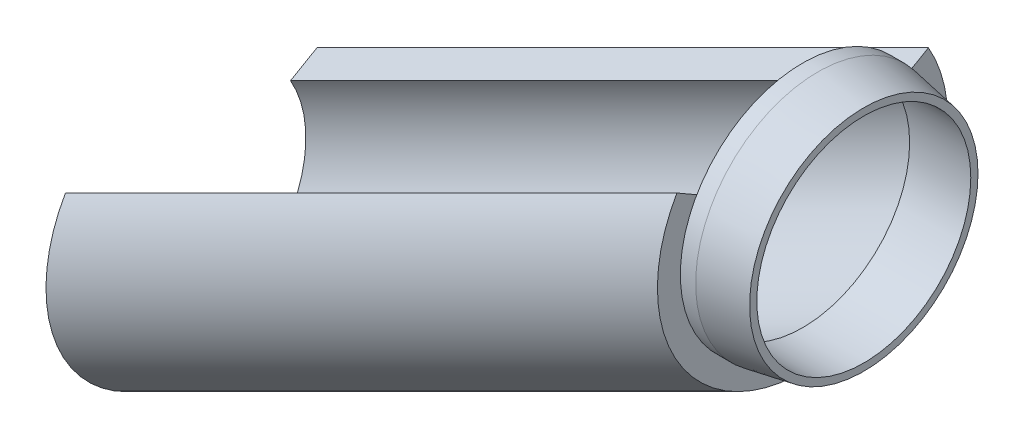
from build123d import *

# Parameters (mm, degrees)
SKETCH5_R           = 8
SKETCH5_R_2         = 7
BOSS_EXTRUDE1_DEPTH = 4
CHAMFER1_SIZE       = 3
CHAMFER1_SIZE2      = 0.528980942


with BuildPart() as part:
    # Sweep1: sweep along a path in Sketch4
    with BuildLine(Plane.XY) as sweep1_path:
        Line((0, 0), (-40, -20))
    # Sketch1 → Sweep1 (sweep)
    with BuildSketch(Plane(origin=(0, 0, 0), x_dir=(0, 0, -1), z_dir=(1, 0, 0))):
        with BuildLine():
            Line((6.495190528, 3.75), (8.227241336, 4.75))
            ThreePointArc((8.227241336, 4.75), (0, -9.5), (-8.227241336, 4.75))
            Line((-8.227241336, 4.75), (-6.495190528, 3.75))
            ThreePointArc((-6.495190528, 3.75), (0, -7.5), (6.495190528, 3.75))
        make_face()
    sweep(path=sweep1_path.line)


with BuildPart() as body_2:
    # Sketch5 → Boss-Extrude1 (new body)
    with BuildSketch(Plane(origin=(0, 0, 0), x_dir=(0, 0, -1), z_dir=(1, 0, 0))):
        Circle(SKETCH5_R)
        Circle(SKETCH5_R_2, mode=Mode.SUBTRACT)
    extrude(amount=BOSS_EXTRUDE1_DEPTH)

    # Chamfer1
    chamfer1_edges = [body_2.edges().sort_by_distance(p)[0] for p in [
        (4, 0, 8),
    ]]
    chamfer1_side = [body_2.faces().sort_by_distance(p)[0] for p in [
        (2, 0, 8),
    ]]
    chamfer(chamfer1_edges, length=CHAMFER1_SIZE, length2=CHAMFER1_SIZE2, reference=chamfer1_side[0])


solid = Compound([part.part, body_2.part])
